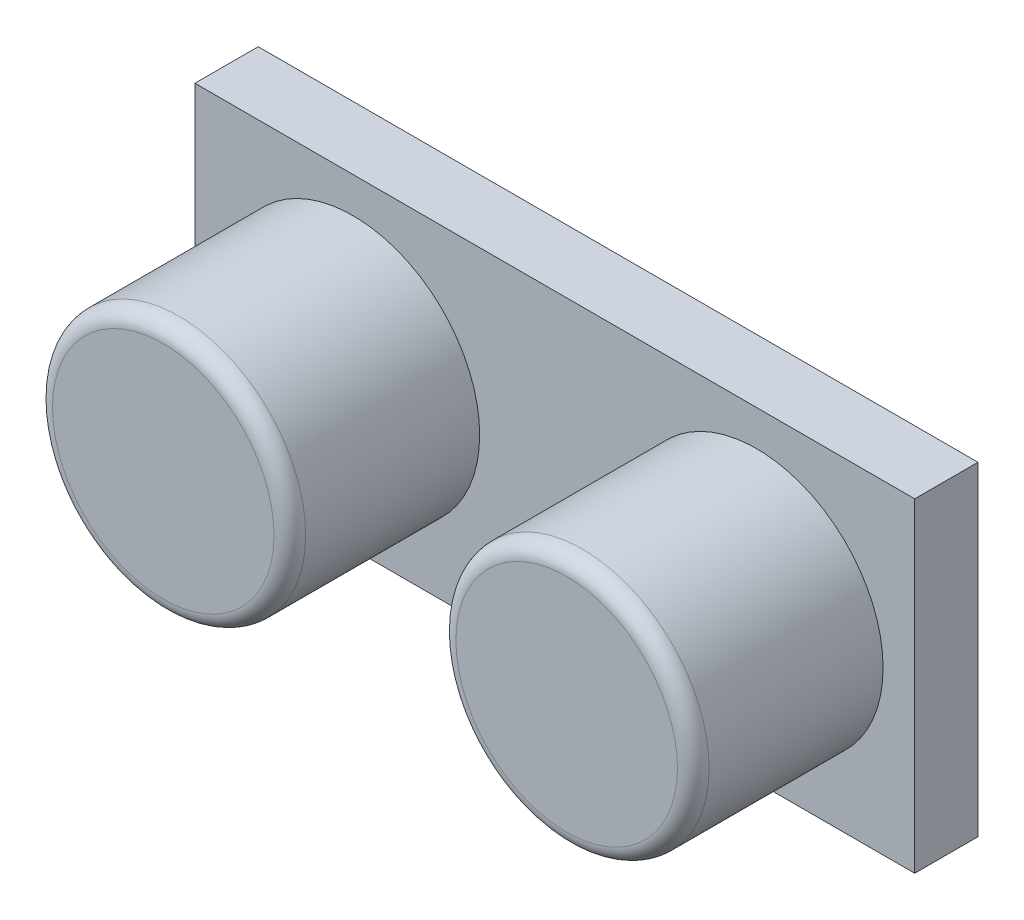
from build123d import *

# Parameters (mm, degrees)
SKETCH1_W           = 45.5
SKETCH1_H           = 20.5
BOSS_EXTRUDE1_DEPTH = 4
SKETCH2_R           = 8
BOSS_EXTRUDE2_DEPTH = 12
FILLET1_R           = 1


with BuildPart() as part:
    # Sketch1 → Boss-Extrude1 (new body)
    with BuildSketch(Plane.XY):
        Rectangle(SKETCH1_W, SKETCH1_H)
    extrude(amount=BOSS_EXTRUDE1_DEPTH)

    # Sketch2 → Boss-Extrude2 (add)
    with BuildSketch(Plane.XY.offset(4)):
        with Locations(Location((-12.75, 0, 0), (0, 0, 180))):
            Circle(SKETCH2_R)
        with Locations(Location((12.75, 0, 0), (0, 0, 180))):
            Circle(SKETCH2_R)
    extrude(amount=BOSS_EXTRUDE2_DEPTH)

    # Fillet1
    fillet1_edges = [part.edges().sort_by_distance(p)[0] for p in [
        (-4.75, 0, 16),
        (20.75, 0, 16),
    ]]
    fillet(fillet1_edges, radius=FILLET1_R)


solid = part.part
